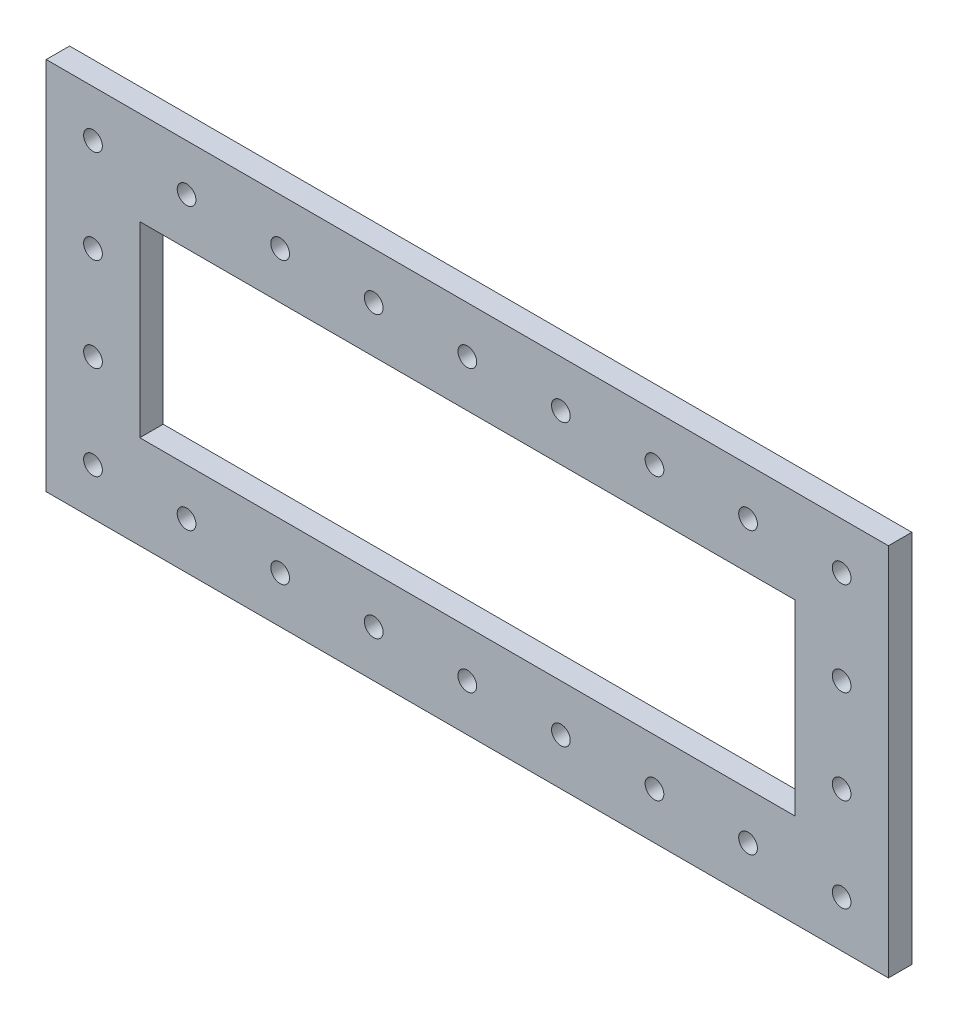
from build123d import *

# Parameters (mm, degrees)
BOSS_EXTRUDE1_DEPTH = 6.35
SKETCH2_R           = 2.54
CUT_EXTRUDE1_DEPTH  = 235.26250767


with BuildPart() as part:
    # Sketch1 → Boss-Extrude1 (new body)
    with BuildSketch(Plane.XY):
        Polygon((0, 0), (0, 50.8), (25.4, 50.8), (25.4, 25.4), (203.2, 25.4), (203.2, 50.8), (228.6, 50.8), (228.6, 0), align=None)
    boss_extrude1 = extrude(amount=BOSS_EXTRUDE1_DEPTH)

    # Sketch2 → Cut-Extrude1 (cut, through all)
    with BuildSketch(Plane.XY.offset(6.35)):
        with Locations((12.7, 38.1)):
            Circle(SKETCH2_R)
        with Locations((12.7, 12.7)):
            Circle(SKETCH2_R)
        with Locations((38.1, 12.7)):
            Circle(SKETCH2_R)
        with Locations((63.5, 12.7)):
            Circle(SKETCH2_R)
        with Locations((88.9, 12.7)):
            Circle(SKETCH2_R)
        with Locations((114.3, 12.7)):
            Circle(SKETCH2_R)
        with Locations((139.7, 12.7)):
            Circle(SKETCH2_R)
        with Locations((165.1, 12.7)):
            Circle(SKETCH2_R)
        with Locations((190.5, 12.7)):
            Circle(SKETCH2_R)
        with Locations((215.9, 12.7)):
            Circle(SKETCH2_R)
        with Locations(Location((215.9, 38.1, 0), (0, 0, 180))):
            Circle(SKETCH2_R)
    cut_extrude1 = extrude(amount=-CUT_EXTRUDE1_DEPTH, mode=Mode.SUBTRACT)

    # Mirror2: Boss-Extrude1, Cut-Extrude1 across plane
    add(boss_extrude1.mirror(Plane(origin=(0, 50.8, 6.35), x_dir=(0, 0, 1), z_dir=(0, -1, 0))))
    add(cut_extrude1.mirror(Plane(origin=(0, 50.8, 6.35), x_dir=(0, 0, 1), z_dir=(0, -1, 0))), mode=Mode.SUBTRACT)


solid = part.part
